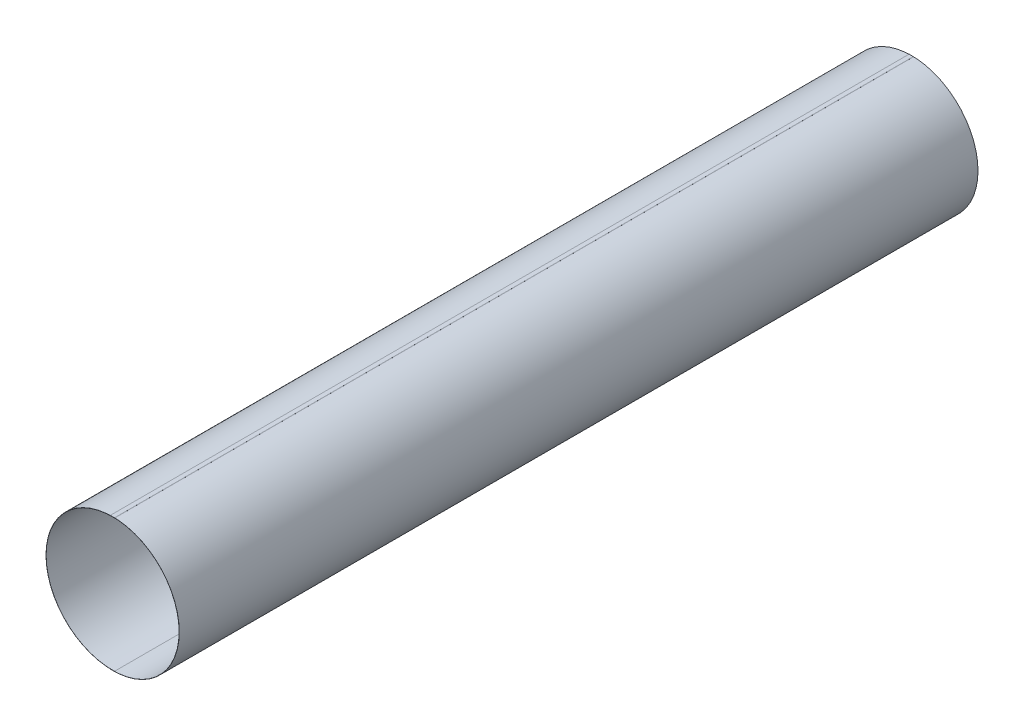
from build123d import *

# Parameters (mm, degrees)
EXTRUDE_THIN4_DEPTH = 1828.8
EXTRUDE_THIN5_DEPTH = 1828.8


with BuildPart() as part:
    # Sketch4 → Extrude-Thin4 (new body)
    with BuildSketch(Plane(origin=(0, 0, 0), x_dir=(0, 1, 0), z_dir=(0, 0, 1))):
        with BuildLine():
            ThreePointArc((-152.317956919, -5), (0, 152.4), (152.317956919, -5))
            Line((152.317956919, -5), (152.064093658, -4.991666667))
            ThreePointArc((152.064093658, -4.991666667), (0, 152.146), (-152.064093658, -4.991666667))
            Line((-152.064093658, -4.991666667), (-152.317956919, -5))
        make_face()
    extrude(amount=EXTRUDE_THIN4_DEPTH)


with BuildPart() as body_2:
    # Sketch4<4> → Extrude-Thin5 (new body)
    with BuildSketch(Plane(origin=(0, 0, 0), x_dir=(0, 1, 0), z_dir=(0, 0, 1))):
        with BuildLine():
            ThreePointArc((-152.317956919, 5), (0, -152.4), (152.317956919, 5))
            Line((152.317956919, 5), (152.571820181, 5.008333333))
            ThreePointArc((152.571820181, 5.008333333), (0, -152.654), (-152.571820181, 5.008333333))
            Line((-152.571820181, 5.008333333), (-152.317956919, 5))
        make_face()
    extrude(amount=EXTRUDE_THIN5_DEPTH)


solid = Compound([part.part, body_2.part])
